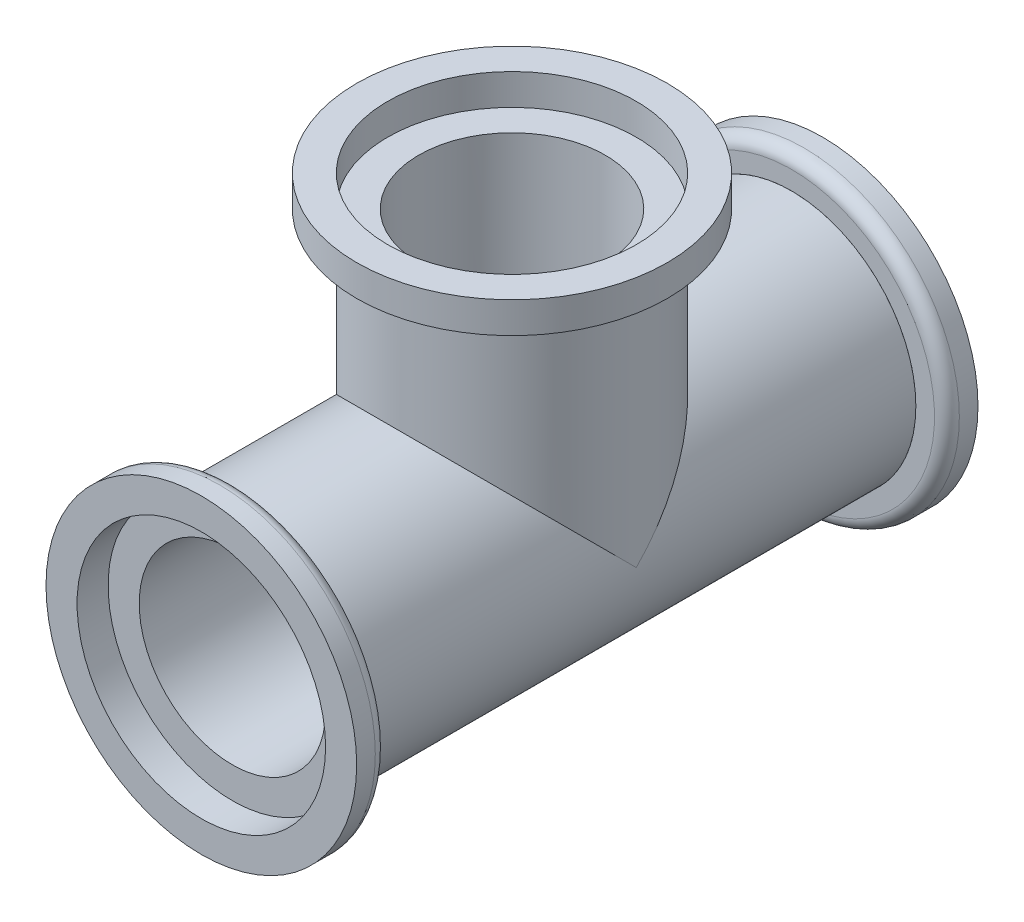
from build123d import *

# Parameters (mm, degrees)
SALIENTE_EXTRUIR1_DEPTH      = 22.5
SALIENTE_EXTRUIR1_DEPTH_BACK = 22.5
CROQUIS2_R                   = 10
CROQUIS2_R_2                 = 7.5
CROQUIS3_R                   = 12.5
CROQUIS3_R_2                 = 10
SALIENTE_EXTRUIR2_DEPTH      = 2.5
REDONDEO1_R                  = 1
CROQUIS4_R                   = 12.5
CROQUIS4_R_2                 = 10
SALIENTE_EXTRUIR3_DEPTH      = 2.5
REDONDEO2_R                  = 1
SALIENTE_EXTRUIR4_REACH      = 44.866
SALIENTE_EXTRUIR4_END_RADIUS = 10
CROQUIS5_R                   = 10
CROQUIS5_R_2                 = 7.5
CROQUIS7_R                   = 12.5
CROQUIS7_R_2                 = 10
SALIENTE_EXTRUIR5_DEPTH      = 2.5
CROQUIS8_R                   = 7.5
CORTAR_EXTRUIR4_DEPTH        = 18.5


with BuildPart() as part:
    # Croquis2 → Saliente-Extruir1 (new, two sides: drawn at the far end of the back side and taken through both)
    with BuildSketch(Plane.XY.offset(-SALIENTE_EXTRUIR1_DEPTH_BACK)):
        Circle(CROQUIS2_R)
        Circle(CROQUIS2_R_2, mode=Mode.SUBTRACT)
    extrude(amount=SALIENTE_EXTRUIR1_DEPTH + SALIENTE_EXTRUIR1_DEPTH_BACK)

    # Saliente-Extruir4: up to this cylinder (the profile starts outside it)
    saliente_extruir4_end = Plane(origin=(0, 0, -9.717157), z_dir=(0, 0, 1)) * Cylinder(SALIENTE_EXTRUIR4_END_RADIUS, 110.732, mode=Mode.PRIVATE)
    # Croquis5 → Saliente-Extruir4 (add, up to the surface)
    with BuildSketch(Plane(origin=(0, 20, 0), x_dir=(1, 0, 0), z_dir=(0, 1, 0)), mode=Mode.PRIVATE) as saliente_extruir4_sk1:
        with Locations(Location((0, 0, 0), (0, 0, 270))):
            Circle(CROQUIS5_R)
        with Locations(Location((0, 0, 0), (0, 0, 270))):
            Circle(CROQUIS5_R_2, mode=Mode.SUBTRACT)
    saliente_extruir4_tool1 = extrude(saliente_extruir4_sk1.sketch, amount=-SALIENTE_EXTRUIR4_REACH, mode=Mode.PRIVATE) - saliente_extruir4_end
    add(saliente_extruir4_tool1.solids().sort_by_distance((0, 20, -9.717157))[0])

    # Croquis8 → Cortar-Extruir4 (cut)
    with BuildSketch(Plane(origin=(0, 20, 0), x_dir=(1, 0, 0), z_dir=(0, 1, 0))):
        with Locations(Location((0, 0, 0), (0, 0, 270))):
            Circle(CROQUIS8_R)
    extrude(amount=-CORTAR_EXTRUIR4_DEPTH, mode=Mode.SUBTRACT)


with BuildPart() as body_2:
    # Croquis3 → Saliente-Extruir2 (new body)
    with BuildSketch(Plane.XY.offset(22.5)):
        Circle(CROQUIS3_R)
        Circle(CROQUIS3_R_2, mode=Mode.SUBTRACT)
    extrude(amount=SALIENTE_EXTRUIR2_DEPTH)

    # Redondeo1
    redondeo1_edges = [body_2.edges().sort_by_distance(p)[0] for p in [
        (-12.5, 0, 22.5),
    ]]
    fillet(redondeo1_edges, radius=REDONDEO1_R)


with BuildPart() as body_3:
    # Croquis4 → Saliente-Extruir3 (new body)
    with BuildSketch(Plane(origin=(0, 0, -22.5), x_dir=(-1, 0, 0), z_dir=(0, 0, -1))):
        Circle(CROQUIS4_R)
        Circle(CROQUIS4_R_2, mode=Mode.SUBTRACT)
    extrude(amount=SALIENTE_EXTRUIR3_DEPTH)

    # Redondeo2
    redondeo2_edges = [body_3.edges().sort_by_distance(p)[0] for p in [
        (12.5, 0, -22.5),
    ]]
    fillet(redondeo2_edges, radius=REDONDEO2_R)


with BuildPart() as body_4:
    # Croquis7 → Saliente-Extruir5 (new body)
    with BuildSketch(Plane(origin=(0, 20, 0), x_dir=(1, 0, 0), z_dir=(0, 1, 0))):
        with Locations(Location((0, 0, 0), (0, 0, 270))):
            Circle(CROQUIS7_R)
        with Locations(Location((0, 0, 0), (0, 0, 270))):
            Circle(CROQUIS7_R_2, mode=Mode.SUBTRACT)
    extrude(amount=SALIENTE_EXTRUIR5_DEPTH)


solid = Compound([part.part, body_2.part, body_3.part, body_4.part])
